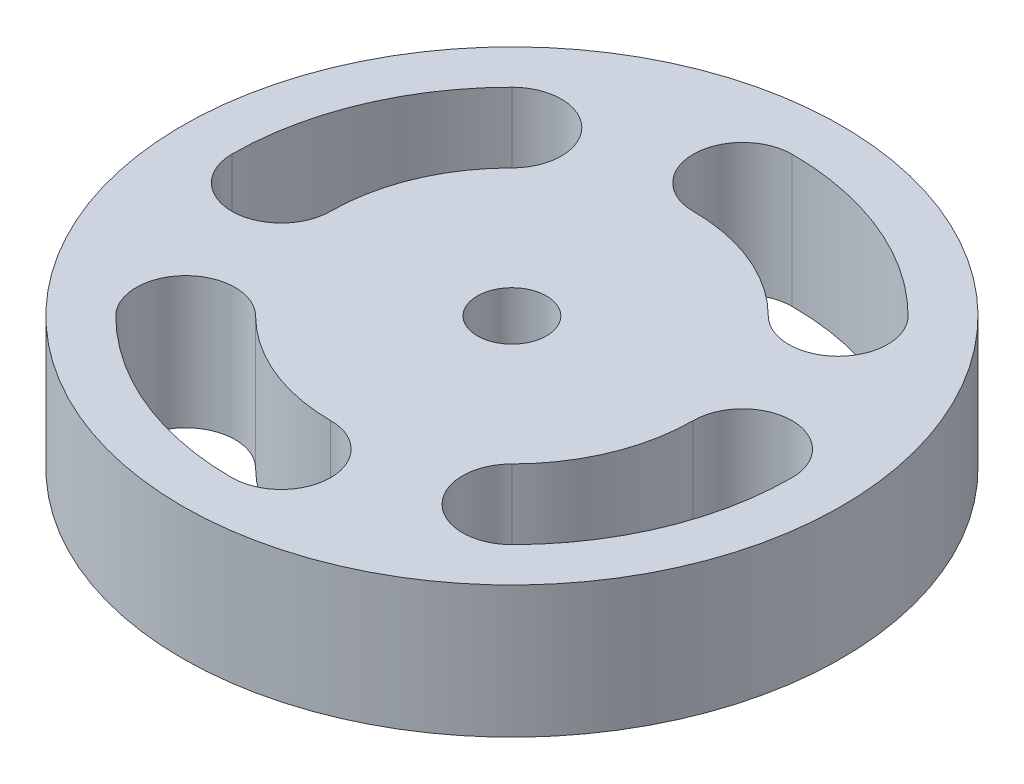
from build123d import *

# Parameters (mm, degrees)
SKETCH_1_R          = 50
EXTRUDE_1_DEPTH     = 20
SKETCH_2_R          = 5.25
CUT_EXTRUDE_1_DEPTH = 20
CUT_EXTRUDE_2_DEPTH = 20


with BuildPart() as part:
    # 草图1 → 凸台-拉伸1 (new body)
    with BuildSketch(Plane(origin=(0, 0, 0), x_dir=(1, 0, 0), z_dir=(0, 1, 0))):
        with Locations(Location((0, 0, 0), (0, 0, 270))):
            Circle(SKETCH_1_R)
    extrude(amount=EXTRUDE_1_DEPTH)

    # 草图2 → 切除-拉伸1 (cut)
    with BuildSketch(Plane(origin=(0, 20, 0), x_dir=(1, 0, 0), z_dir=(0, 1, 0))):
        with Locations(Location((0, 0, 0), (0, 0, 270))):
            Circle(SKETCH_2_R)
    extrude(amount=-CUT_EXTRUDE_1_DEPTH, mode=Mode.SUBTRACT)

    # 草图3 → 切除-拉伸2 (cut)
    with BuildSketch(Plane(origin=(0, 20, 0), x_dir=(1, 0, 0), z_dir=(0, 1, 0))):
        with BuildLine():
            ThreePointArc((42.5, 0), (35, 7.5), (27.5, 0))
            ThreePointArc((27.5, 0), (25.406687144, -10.52379439), (19.445436483, -19.445436483))
            ThreePointArc((19.445436483, -19.445436483), (19.445436477, -30.052038195), (30.052038189, -30.052038212))
            ThreePointArc((30.052038189, -30.052038212), (39.264880129, -16.264045883), (42.5, 0))
        make_face()
        with BuildLine():
            ThreePointArc((2e-09, 27.5), (10.523794391, 25.406687144), (19.445436483, 19.445436483))
            ThreePointArc((19.445436483, 19.445436483), (30.0520382, 19.445436483), (30.0520382, 30.0520382))
            ThreePointArc((30.0520382, 30.0520382), (16.264045902, 39.264880121), (5.8e-08, 42.5))
            ThreePointArc((5.8e-08, 42.5), (-7.5, 35.000000028), (2e-09, 27.5))
        make_face()
        with BuildLine():
            ThreePointArc((-30.0520382, -30.0520382), (-16.264045799, -39.264880163), (1.65e-07, -42.5))
            ThreePointArc((1.65e-07, -42.5), (7.5, -34.999999948), (6.1e-08, -27.5))
            ThreePointArc((6.1e-08, -27.5), (-10.523794348, -25.406687162), (-19.44543646, -19.445436505))
            ThreePointArc((-19.44543646, -19.445436505), (-30.052038189, -19.445436472), (-30.0520382, -30.0520382))
        make_face()
        with BuildLine():
            ThreePointArc((-27.5, 0), (-25.406687154, 10.523794365), (-19.445436521, 19.445436445))
            ThreePointArc((-19.445436521, 19.445436445), (-19.445436492, 30.05203821), (-30.052038258, 30.052038143))
            ThreePointArc((-30.052038258, 30.052038143), (-39.264880164, 16.264045797), (-42.5, -8.9e-08))
            ThreePointArc((-42.5, -8.9e-08), (-34.999999956, -7.5), (-27.5, 0))
        make_face()
    extrude(amount=-CUT_EXTRUDE_2_DEPTH, mode=Mode.SUBTRACT)


solid = part.part
